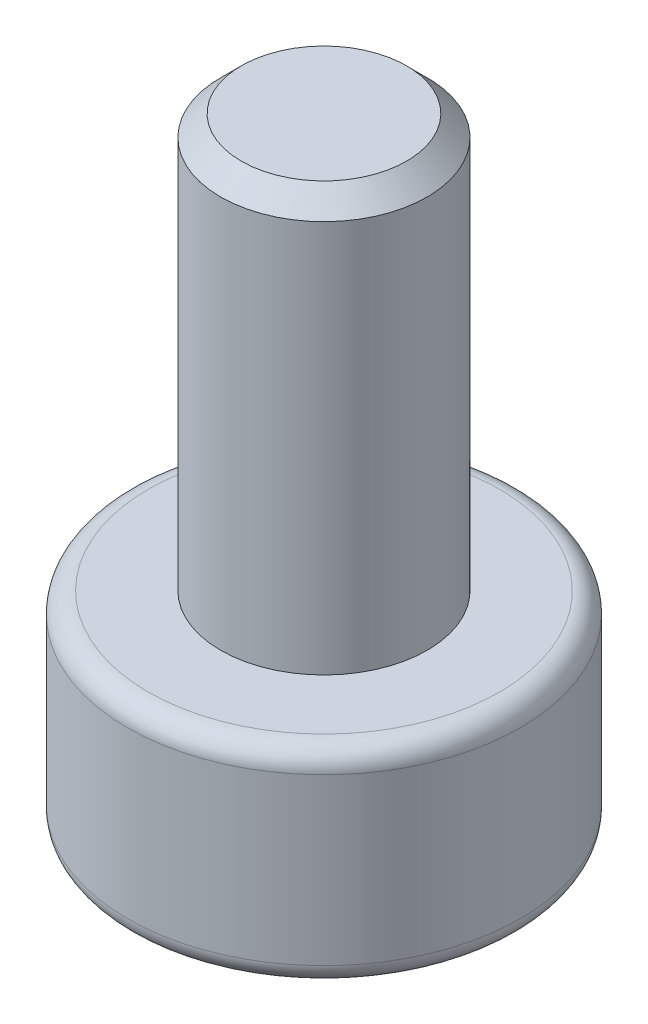
from build123d import *

# Parameters (mm, degrees)
SKETCH_1_R          = 2.85
EXTRUDE_1_DEPTH     = 3
SKETCH_2_R          = 1.5
EXTRUDE_2_DEPTH     = 6
SKETCH_3_R          = 1.29
CUT_EXTRUDE_1_DEPTH = 1.3
FILLET_1_R          = 0.3
CHAMFER_1_SIZE      = 0.3
CHAMFER_2_SIZE      = 0.15


with BuildPart() as part:
    # 草图1 → 凸台-拉伸1 (new body)
    with BuildSketch(Plane(origin=(0, 0, 0), x_dir=(1, 0, 0), z_dir=(0, 1, 0))):
        with Locations(Location((0, 0, 0), (0, 0, 270))):
            Circle(SKETCH_1_R)
    extrude(amount=EXTRUDE_1_DEPTH)

    # 草图2 → 凸台-拉伸2 (add)
    with BuildSketch(Plane(origin=(0, 3, 0), x_dir=(1, 0, 0), z_dir=(0, 1, 0))):
        with Locations(Location((0, 0, 0), (0, 0, 270))):
            Circle(SKETCH_2_R)
    extrude(amount=EXTRUDE_2_DEPTH)

    # 草图3 → 切除-拉伸1 (cut)
    with BuildSketch(Plane.XZ):
        with Locations(Location((0, 0, 0), (0, 0, 270))):
            Circle(SKETCH_3_R)
    extrude(amount=-CUT_EXTRUDE_1_DEPTH, mode=Mode.SUBTRACT)

    # 圆角1
    fillet_1_edges = [part.edges().sort_by_distance(p)[0] for p in [
        (0, 0, -2.85),
        (0, 3, -2.85),
    ]]
    fillet(fillet_1_edges, radius=FILLET_1_R)

    # 倒角1
    chamfer_1_edges = [part.edges().sort_by_distance(p)[0] for p in [
        (0, 9, -1.5),
    ]]
    chamfer(chamfer_1_edges, length=CHAMFER_1_SIZE)

    # 倒角2
    chamfer_2_edges = [part.edges().sort_by_distance(p)[0] for p in [
        (0, 0, 1.29),
    ]]
    chamfer(chamfer_2_edges, length=CHAMFER_2_SIZE)


solid = part.part
